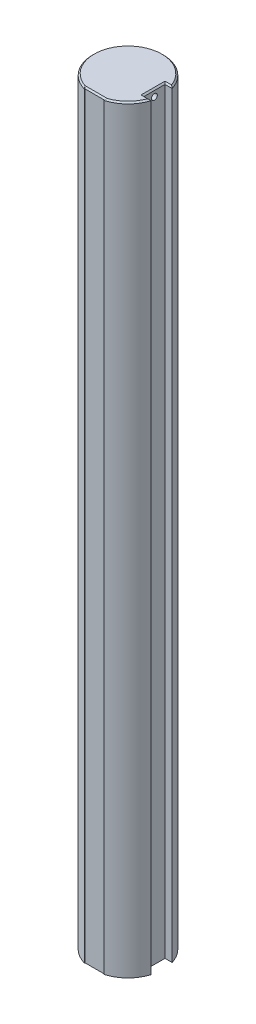
from build123d import *

# Parameters (mm, degrees)
ESQUISSE1_R                         = 20
BOSS_EXTRU_1_DEPTH                  = 430.4
TROU_TARAUD_M81_D                   = 6.8
TROU_TARAUD_M81_DEPTH               = 22.25
TROU_TARAUD_M81_TIP                 = 2.042926105
ENL_V_MAT_EXTRU_1_REACH             = 433.328
ENL_V_MAT_EXTRU_1_DIRECTION_2_DEPTH = 432.328366793
TROU_TARAUD_M41_D                   = 3.3
TROU_TARAUD_M41_DEPTH               = 11.5
TROU_TARAUD_M41_TIP                 = 0.991420021
CHANFREIN1_SIZE                     = 0.8


with BuildPart() as part:
    # Esquisse1 → Boss.-Extru.1 (new body)
    with BuildSketch(Plane(origin=(0, 0, 0), x_dir=(1, 0, 0), z_dir=(0, 1, 0))):
        with Locations(Location((0, 0, 0), (0, 0, 90))):
            Circle(ESQUISSE1_R)
    extrude(amount=BOSS_EXTRU_1_DEPTH)

    # Trou taraudé M81
    with Locations(Plane(origin=(0, 0, 0), x_dir=(-1, 0, 0), z_dir=(0, -1, 0))):
        with Locations((0, -12.5), (0, 12.5)):
            Hole(TROU_TARAUD_M81_D / 2, depth=TROU_TARAUD_M81_DEPTH)
            with Locations((0, 0, -(TROU_TARAUD_M81_DEPTH + TROU_TARAUD_M81_TIP / 2))):  # 118° drill point
                Cone(0, TROU_TARAUD_M81_D / 2, TROU_TARAUD_M81_TIP, mode=Mode.SUBTRACT)

    # Esquisse8 → Enlèv. mat.-Extru.1 (cut, up to next)
    with BuildSketch(Plane.XZ, mode=Mode.PRIVATE) as enl_v_mat_extru_1_sk1:
        with BuildLine():
            Line((-5.5, 19.228884523), (-5.5, 18.9))
            Line((-5.5, 18.9), (5.5, 18.9))
            Line((5.5, 18.9), (5.5, 19.228884523))
            ThreePointArc((5.5, 19.228884523), (0, 20), (-5.5, 19.228884523))
        make_face()
    enl_v_mat_extru_1_tool1 = extrude(enl_v_mat_extru_1_sk1.sketch, amount=-ENL_V_MAT_EXTRU_1_REACH, mode=Mode.PRIVATE) & part.part
    # Esquisse8 → Enlèv. mat.-Extru.1 (cut, up to next)
    with BuildSketch(Plane.XZ, mode=Mode.PRIVATE) as enl_v_mat_extru_1_sk2:
        with BuildLine():
            Line((19.078784028, 6), (15, 6))
            Line((15, 6), (15, -6))
            Line((15, -6), (19.078784028, -6))
            ThreePointArc((19.078784028, -6), (20, 0), (19.078784028, 6))
        make_face()
    enl_v_mat_extru_1_tool2 = extrude(enl_v_mat_extru_1_sk2.sketch, amount=-ENL_V_MAT_EXTRU_1_REACH, mode=Mode.PRIVATE) & part.part
    add(enl_v_mat_extru_1_tool1.solids().sort_by_distance((0, 0, 19.353586))[0], mode=Mode.SUBTRACT)
    add(enl_v_mat_extru_1_tool2.solids().sort_by_distance((17.355884, 0, 0))[0], mode=Mode.SUBTRACT)

    # Esquisse8 → Enlèv. mat.-Extru.1 direction 2 (cut)
    with BuildSketch(Plane.XZ):
        with BuildLine():
            Line((-5.5, 19.228884523), (-5.5, 18.9))
            Line((-5.5, 18.9), (5.5, 18.9))
            Line((5.5, 18.9), (5.5, 19.228884523))
            ThreePointArc((5.5, 19.228884523), (0, 20), (-5.5, 19.228884523))
        make_face()
        with BuildLine():
            Line((19.078784028, 6), (15, 6))
            Line((15, 6), (15, -6))
            Line((15, -6), (19.078784028, -6))
            ThreePointArc((19.078784028, -6), (20, 0), (19.078784028, 6))
        make_face()
    extrude(amount=ENL_V_MAT_EXTRU_1_DIRECTION_2_DEPTH, mode=Mode.SUBTRACT)

    # Trou taraudé M41
    with Locations(Plane(origin=(15, 0, 0), x_dir=(0, 0, -1), z_dir=(1, 0, 0))):
        with Locations((0, 426.4)):
            Hole(TROU_TARAUD_M41_D / 2, depth=TROU_TARAUD_M41_DEPTH)
            with Locations((0, 0, -(TROU_TARAUD_M41_DEPTH + TROU_TARAUD_M41_TIP / 2))):  # 118° drill point
                Cone(0, TROU_TARAUD_M41_D / 2, TROU_TARAUD_M41_TIP, mode=Mode.SUBTRACT)

    # Chanfrein1
    chanfrein1_edges = [part.edges().sort_by_distance(p)[0] for p in [
        (5.5, 430.4, 19.064442262),
        (0, 430.4, 18.9),
        (-5.5, 430.4, 19.064442262),
        (-14.325501649, 430.4, -13.956360647),
        (17.039392014, 430.4, -6),
        (15, 430.4, 0),
        (17.039392014, 430.4, 6),
        (13.956360647, 430.4, 14.325501649),
    ]]
    chamfer(chanfrein1_edges, length=CHANFREIN1_SIZE)


solid = part.part
